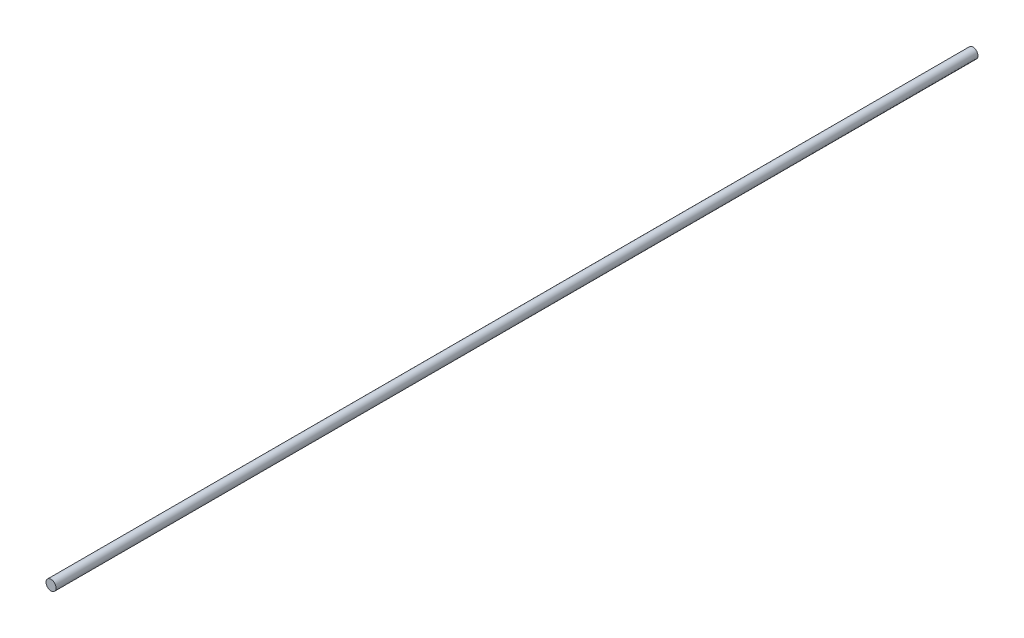
from build123d import *

# Parameters (mm, degrees)
SKETCH1_R           = 6.1
BOSS_EXTRUDE1_DEPTH = 560


with BuildPart() as part:
    # Sketch1 → Boss-Extrude1 (new, symmetric)
    with BuildSketch(Plane.XY):
        Circle(SKETCH1_R)
    extrude(amount=BOSS_EXTRUDE1_DEPTH, both=True)


solid = part.part
